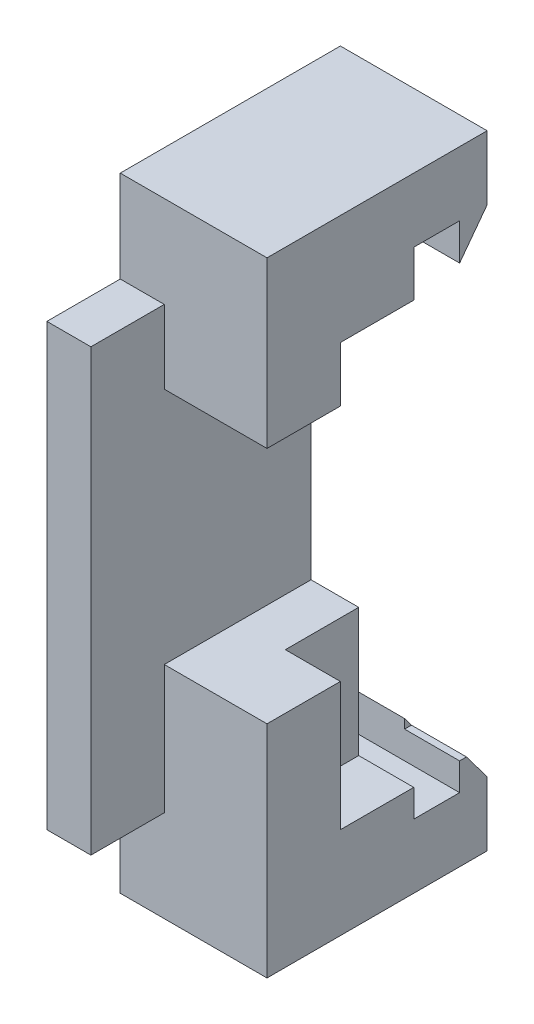
from build123d import *

# Parameters (mm, degrees)
SKETCH1_W           = 4
SKETCH1_H           = 17
BOSS_EXTRUDE1_DEPTH = 6
SKETCH2_W           = 2.8
SKETCH2_H           = 6.5
SKETCH2_W_2         = 1.5
SKETCH2_H_2         = 2.75
CUT_EXTRUDE1_DEPTH  = 19.466185313
CUT_EXTRUDE2_DEPTH  = 19.466185313
SKETCH4_W           = 2
SKETCH4_H           = 2.75
BOSS_EXTRUDE2_DEPTH = 2
SKETCH5_W           = 1.2
SKETCH5_H           = 12
BOSS_EXTRUDE3_DEPTH = 2
SKETCH6_W           = 1.5
SKETCH6_H           = 1.5
SKETCH6_H_2         = 0.75
CUT_EXTRUDE3_DEPTH  = 2


with BuildPart() as part:
    # Sketch1 → Boss-Extrude1 (new body)
    with BuildSketch(Plane.XY):
        with Locations((2, 8.5)):
            Rectangle(SKETCH1_W, SKETCH1_H)
    extrude(amount=BOSS_EXTRUDE1_DEPTH)

    # Sketch2 → Cut-Extrude1 (cut, through all)
    with BuildSketch(Plane.XY.offset(6)):
        with Locations((2.6, 9.25)):
            Rectangle(SKETCH2_W, SKETCH2_H)
        with Locations((3.25, 3.875)):
            Rectangle(SKETCH2_W_2, SKETCH2_H_2)
    extrude(amount=-CUT_EXTRUDE1_DEPTH, mode=Mode.SUBTRACT)

    # Sketch3 → Cut-Extrude2 (cut, through all)
    with BuildSketch(Plane.ZY):
        Polygon((0, 15.25), (0.75, 14.25), (0.75, 15.25), (2, 15.25), (2, 1.75), (0.75, 1.75), (0.75, 2.75), (0, 1.75), align=None)
    extrude(amount=-CUT_EXTRUDE2_DEPTH, mode=Mode.SUBTRACT)

    # Sketch4 → Boss-Extrude2 (add)
    with BuildSketch(Plane(origin=(4, 0, 0), x_dir=(0, 0, -1), z_dir=(1, 0, 0))):
        with Locations((-5, 3.875)):
            Rectangle(SKETCH4_W, SKETCH4_H)
    extrude(amount=-BOSS_EXTRUDE2_DEPTH)

    # Sketch5 → Boss-Extrude3 (add)
    with BuildSketch(Plane.XY.offset(6)):
        with Locations((0.6, 8.5)):
            Rectangle(SKETCH5_W, SKETCH5_H)
    extrude(amount=BOSS_EXTRUDE3_DEPTH)

    # Sketch6 → Cut-Extrude3 (cut)
    with BuildSketch(Plane(origin=(0, 0, 2), x_dir=(-1, 0, 0), z_dir=(0, 0, -1))):
        with Locations((-3.25, 13.25)):
            Rectangle(SKETCH6_W, SKETCH6_H)
        with Locations((-3.25, 5.625)):
            Rectangle(SKETCH6_W, SKETCH6_H_2)
    extrude(amount=-CUT_EXTRUDE3_DEPTH, mode=Mode.SUBTRACT)


solid = part.part
